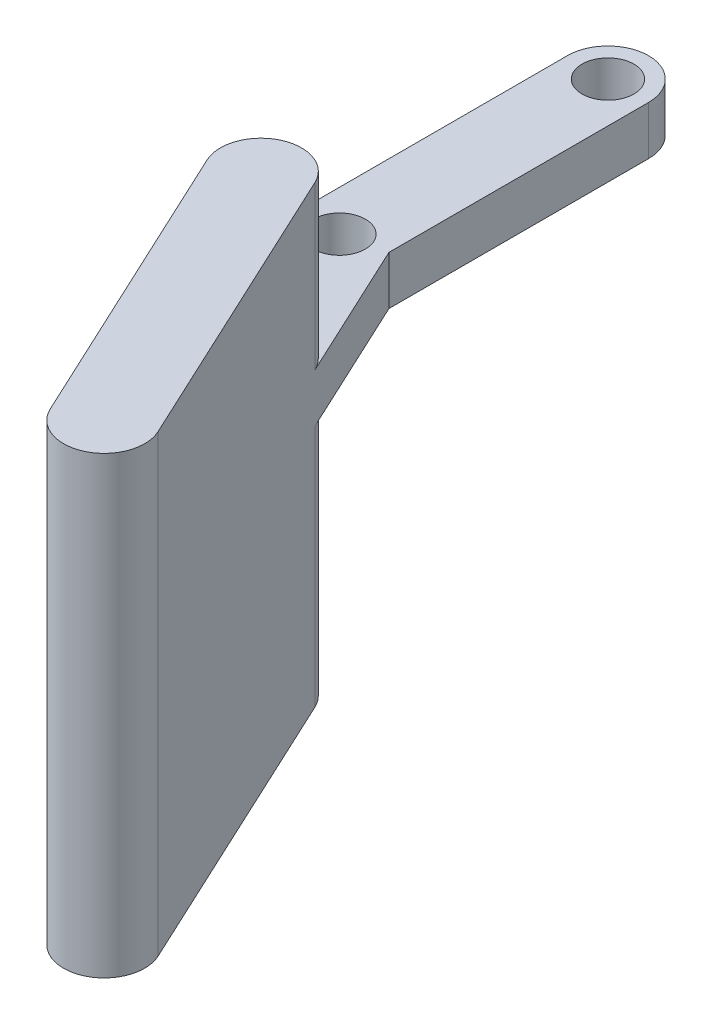
from build123d import *

# Parameters (mm, degrees)
BOSS_EXTRUDE1_DEPTH = 3
BOSS_EXTRUDE2_START = -3
BOSS_EXTRUDE2_DEPTH = 3
SKETCH3_R           = 1.6
CUT_EXTRUDE1_DEPTH  = 49.760896398
BOSS_EXTRUDE3_START = 15
BOSS_EXTRUDE3_DEPTH = 15
BOSS_EXTRUDE4_DEPTH = 10


with BuildPart() as part:
    # Sketch1 → Boss-Extrude1 (new body)
    with BuildSketch(Plane(origin=(0, 0, 0), x_dir=(1, 0, 0), z_dir=(0, 1, 0))):
        with BuildLine():
            Line((2.5, 0), (2.5, -16.552945357))
            ThreePointArc((2.5, -16.552945357), (0, -19.052945357), (-2.5, -16.552945357))
            Line((-2.5, -16.552945357), (-2.5, 0))
            ThreePointArc((-2.5, 0), (0, 2.5), (2.5, 0))
        make_face()
    extrude(amount=BOSS_EXTRUDE1_DEPTH)

    # Sketch2 → Boss-Extrude2 (add)
    with BuildSketch(Plane(origin=(0, 3, 0), x_dir=(1, 0, 0), z_dir=(0, 1, 0)).offset(BOSS_EXTRUDE2_START)):
        with BuildLine():
            Line((2.26545785, -15.495731694), (14.95202181, -42.681225894))
            ThreePointArc((14.95202181, -42.681225894), (13.743777623, -46.003897407), (10.42110611, -44.79565322))
            Line((10.42110611, -44.79565322), (-2.26545785, -17.610159021))
            ThreePointArc((-2.26545785, -17.610159021), (-1.057213663, -14.287487507), (2.26545785, -15.495731694))
        make_face()
    extrude(amount=BOSS_EXTRUDE2_DEPTH)

    # Sketch3 → Cut-Extrude1 (cut, through all)
    with BuildSketch(Plane(origin=(0, 3, 0), x_dir=(1, 0, 0), z_dir=(0, 1, 0))):
        with Locations(Location((0, 0, 0), (0, 0, 270))):
            Circle(SKETCH3_R)
        with Locations(Location((0, -16.552945357, 0), (0, 0, 270))):
            Circle(SKETCH3_R)
    extrude(amount=-CUT_EXTRUDE1_DEPTH, mode=Mode.SUBTRACT)

    # Sketch5 → Boss-Extrude3 (add)
    with BuildSketch(Plane.XZ.offset(BOSS_EXTRUDE3_START)):
        with BuildLine():
            Line((14.95202181, 42.681225894), (6.494312503, 24.557563094))
            ThreePointArc((6.494312503, 24.557563094), (3.171640989, 23.349318908), (1.963396803, 26.671990421))
            Line((1.963396803, 26.671990421), (10.42110611, 44.795653221))
            ThreePointArc((10.42110611, 44.795653221), (13.743777623, 46.003897407), (14.95202181, 42.681225894))
        make_face()
    extrude(amount=-BOSS_EXTRUDE3_DEPTH)

    # Sketch6 → Boss-Extrude4 (add)
    with BuildSketch(Plane(origin=(0, 3, 0), x_dir=(1, 0, 0), z_dir=(0, 1, 0))):
        with BuildLine():
            Line((10.42110611, -44.79565322), (1.963396803, -26.671990421))
            ThreePointArc((1.963396803, -26.671990421), (3.17164099, -23.349318907), (6.494312503, -24.557563094))
            Line((6.494312503, -24.557563094), (14.95202181, -42.681225894))
            ThreePointArc((14.95202181, -42.681225894), (13.743777623, -46.003897407), (10.42110611, -44.79565322))
        make_face()
    extrude(amount=BOSS_EXTRUDE4_DEPTH)


solid = part.part
